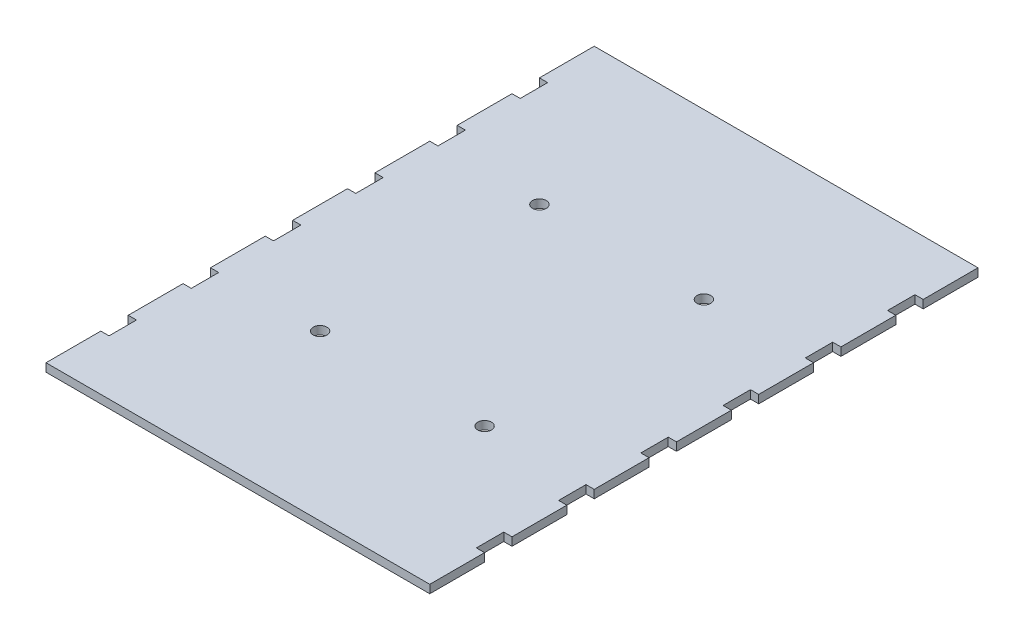
from build123d import *

# Parameters (mm, degrees)
SKETCH1_W           = 140
SKETCH1_H           = 200
BOSS_EXTRUDE1_DEPTH = 3
SKETCH2_R           = 2.5
CUT_EXTRUDE1_DEPTH  = 10
SKETCH3_W           = 3
SKETCH3_H           = 10
CUT_EXTRUDE2_DEPTH  = 10


with BuildPart() as part:
    # Sketch1 → Boss-Extrude1 (new body)
    with BuildSketch(Plane(origin=(0, 0, 0), x_dir=(1, 0, 0), z_dir=(0, 1, 0))):
        Rectangle(SKETCH1_W, SKETCH1_H)
    extrude(amount=BOSS_EXTRUDE1_DEPTH)

    # Sketch2 → Cut-Extrude1 (cut)
    with BuildSketch(Plane(origin=(0, 3, 0), x_dir=(1, 0, 0), z_dir=(0, 1, 0))):
        with Locations(Location((-30, 40, 0), (0, 0, 270))):
            Circle(SKETCH2_R)
        with Locations(Location((30, 40, 0), (0, 0, 270))):
            Circle(SKETCH2_R)
        with Locations(Location((-30, -40, 0), (0, 0, 270))):
            Circle(SKETCH2_R)
        with Locations(Location((30, -40, 0), (0, 0, 270))):
            Circle(SKETCH2_R)
    extrude(amount=-CUT_EXTRUDE1_DEPTH, mode=Mode.SUBTRACT)

    # Sketch3 → Cut-Extrude2 (cut)
    with BuildSketch(Plane(origin=(0, 3, 0), x_dir=(1, 0, 0), z_dir=(0, 1, 0))):
        with Locations((68.5, -45)):
            Rectangle(SKETCH3_W, SKETCH3_H)
        with Locations((68.5, -75)):
            Rectangle(SKETCH3_W, SKETCH3_H)
        with Locations((68.5, -15)):
            Rectangle(SKETCH3_W, SKETCH3_H)
        with Locations((68.5, 15)):
            Rectangle(SKETCH3_W, SKETCH3_H)
        with Locations((68.5, 45)):
            Rectangle(SKETCH3_W, SKETCH3_H)
        with Locations((68.5, 75)):
            Rectangle(SKETCH3_W, SKETCH3_H)
        with Locations((-68.5, -75)):
            Rectangle(SKETCH3_W, SKETCH3_H)
        with Locations((-68.5, -45)):
            Rectangle(SKETCH3_W, SKETCH3_H)
        with Locations((-68.5, -15)):
            Rectangle(SKETCH3_W, SKETCH3_H)
        with Locations((-68.5, 15)):
            Rectangle(SKETCH3_W, SKETCH3_H)
        with Locations((-68.5, 45)):
            Rectangle(SKETCH3_W, SKETCH3_H)
        with Locations((-68.5, 75)):
            Rectangle(SKETCH3_W, SKETCH3_H)
    extrude(amount=-CUT_EXTRUDE2_DEPTH, mode=Mode.SUBTRACT)


solid = part.part
